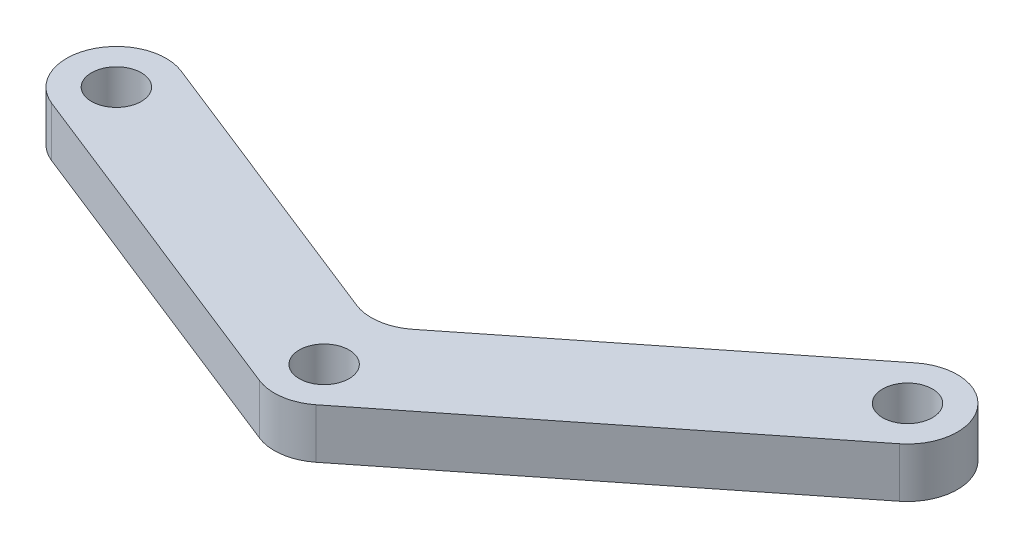
from build123d import *

# Parameters (mm, degrees)
SKETCH3_R           = 1.5
BOSS_EXTRUDE1_DEPTH = 3


with BuildPart() as part:
    # Sketch3 → Boss-Extrude1 (new body)
    with BuildSketch(Plane(origin=(0, 0, 0), x_dir=(1, 0, 0), z_dir=(0, 1, 0))):
        with BuildLine():
            Line((-14.269851191, 40.378529671), (-31.148333324, 27.002739596))
            ThreePointArc((-31.148333324, 27.002739596), (-32.573570891, 26.386103067), (-34.116181095, 26.564698952))
            Line((-34.116181095, 26.564698952), (-51.601960112, 33.489229262))
            ThreePointArc((-51.601960112, 33.489229262), (-55.495781558, 31.804546936), (-53.811099231, 27.910725489))
            Line((-53.811099231, 27.910725489), (-33.10456956, 19.710748113))
            ThreePointArc((-33.10456956, 19.710748113), (-31.561959356, 19.532152229), (-30.136721789, 20.148788758))
            Line((-30.136721789, 20.148788758), (-10.543294768, 35.676107187))
            ThreePointArc((-10.543294768, 35.676107187), (-10.055361737, 39.890596641), (-14.269851191, 40.378529671))
        make_face()
        with Locations(Location((-32, 22.5, 0), (0, 0, 270))):
            Circle(SKETCH3_R, mode=Mode.SUBTRACT)
        with Locations(Location((-52.706529672, 30.699977376, 0), (0, 0, 270))):
            Circle(SKETCH3_R, mode=Mode.SUBTRACT)
        with Locations(Location((-12.40657298, 38.027318429, 0), (0, 0, 270))):
            Circle(SKETCH3_R, mode=Mode.SUBTRACT)
    extrude(amount=BOSS_EXTRUDE1_DEPTH)


solid = part.part
